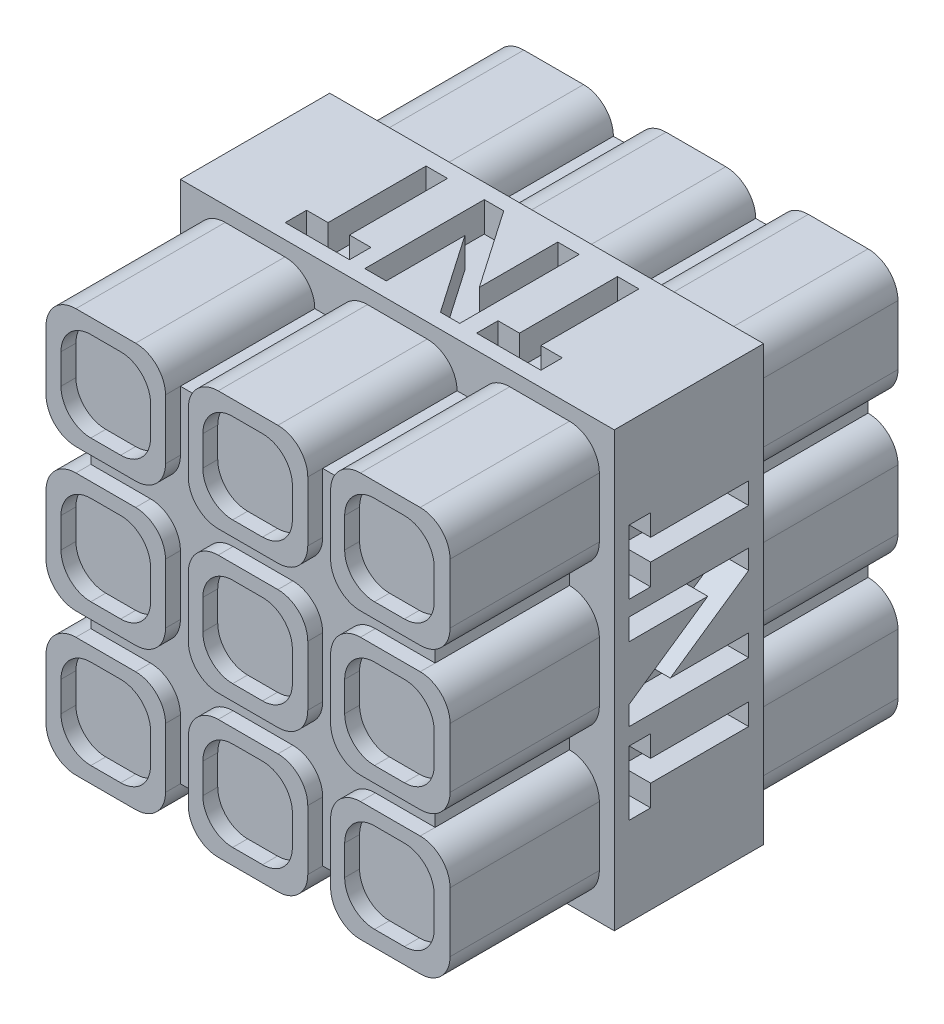
from build123d import *

# Parameters (mm, degrees)
BOSS_EXTRUDE1_DEPTH = 30
SKETCH2_W           = 29.058823529
SKETCH2_H           = 29.058823529
BOSS_EXTRUDE2_DEPTH = 10
CUT_EXTRUDE1_DEPTH  = 2
CIRPATTERN1_COUNT   = 4
CUT_EXTRUDE2_DEPTH  = 1
SKETCH6_W           = 23.058823529
SKETCH6_H           = 1.529411764
SKETCH6_H_2         = 1.529411765
CUT_EXTRUDE3_DEPTH  = 1
SKETCH7_W           = 1.529411765
SKETCH7_H           = 23.058823529
SKETCH7_W_2         = 1.529411764
CUT_EXTRUDE4_DEPTH  = 1
FILLET1_R           = 2


with BuildPart() as part:
    # Sketch1 → Boss-Extrude1 (new body)
    with BuildSketch(Plane.XY):
        with BuildLine():
            Line((0, -2), (0, -6))
            ThreePointArc((0, -6), (0.585786438, -7.414213562), (2, -8))
            Line((2, -8), (6, -8))
            ThreePointArc((6, -8), (7.414213562, -7.414213562), (8, -6))
            Line((8, -6), (9.529411765, -6))
            ThreePointArc((9.529411765, -6), (10.115198202, -7.414213562), (11.529411765, -8))
            Line((11.529411765, -8), (15.529411765, -8))
            ThreePointArc((15.529411765, -8), (16.943625327, -7.414213562), (17.529411765, -6))
            Line((17.529411765, -6), (19.058823529, -6))
            ThreePointArc((19.058823529, -6), (19.644609967, -7.414213562), (21.058823529, -8))
            Line((21.058823529, -8), (25.058823529, -8))
            ThreePointArc((25.058823529, -8), (26.473037092, -7.414213562), (27.058823529, -6))
            Line((27.058823529, -6), (27.058823529, -2))
            ThreePointArc((27.058823529, -2), (26.473037092, -0.585786438), (25.058823529, 0))
            Line((25.058823529, 0), (25.058823529, 1.529411765))
            ThreePointArc((25.058823529, 1.529411765), (26.473037092, 2.115198202), (27.058823529, 3.529411765))
            Line((27.058823529, 3.529411765), (27.058823529, 7.529411765))
            ThreePointArc((27.058823529, 7.529411765), (26.473037092, 8.943625327), (25.058823529, 9.529411765))
            Line((25.058823529, 9.529411765), (25.058823529, 11.058823529))
            ThreePointArc((25.058823529, 11.058823529), (26.473037092, 11.644609967), (27.058823529, 13.058823529))
            Line((27.058823529, 13.058823529), (27.058823529, 17.058823529))
            ThreePointArc((27.058823529, 17.058823529), (26.473037092, 18.473037092), (25.058823529, 19.058823529))
            Line((25.058823529, 19.058823529), (21.058823529, 19.058823529))
            ThreePointArc((21.058823529, 19.058823529), (19.644609967, 18.473037092), (19.058823529, 17.058823529))
            Line((19.058823529, 17.058823529), (17.529411765, 17.058823529))
            ThreePointArc((17.529411765, 17.058823529), (16.943625327, 18.473037092), (15.529411765, 19.058823529))
            Line((15.529411765, 19.058823529), (11.529411765, 19.058823529))
            ThreePointArc((11.529411765, 19.058823529), (10.115198202, 18.473037092), (9.529411765, 17.058823529))
            Line((9.529411765, 17.058823529), (8, 17.058823529))
            ThreePointArc((8, 17.058823529), (7.414213562, 18.473037092), (6, 19.058823529))
            Line((6, 19.058823529), (2, 19.058823529))
            ThreePointArc((2, 19.058823529), (0.585786438, 18.473037092), (0, 17.058823529))
            Line((0, 17.058823529), (0, 13.058823529))
            ThreePointArc((0, 13.058823529), (0.585786438, 11.644609967), (2, 11.058823529))
            Line((2, 11.058823529), (2, 9.529411765))
            ThreePointArc((2, 9.529411765), (0.585786438, 8.943625327), (0, 7.529411765))
            Line((0, 7.529411765), (0, 3.529411765))
            ThreePointArc((0, 3.529411765), (0.585786438, 2.115198202), (2, 1.529411765))
            Line((2, 1.529411765), (2, 0))
            ThreePointArc((2, 0), (0.585786438, -0.585786438), (0, -2))
        make_face()
    extrude(amount=BOSS_EXTRUDE1_DEPTH)

    # Sketch2 → Boss-Extrude2 (add)
    with BuildSketch(Plane.XY.offset(10)):
        with Locations((13.529411765, 5.529411765)):
            Rectangle(SKETCH2_W, SKETCH2_H)
    extrude(amount=BOSS_EXTRUDE2_DEPTH)

    # Sketch3 → Cut-Extrude1 (cut)
    with BuildSketch(Plane.ZY.offset(1)):
        Polygon((19, 14.14479638), (19, 9.837104072), (17.564102564, 9.837104072), (17.564102564, 11.273001508), (11, 11.273001508), (11, 12.708898944), (17.564102564, 12.708898944), (17.564102564, 14.14479638), align=None)
        Polygon((19, 8.708898944), (19, 7.415629713), (13.735576923, 3.785822021), (19, 3.785822021), (19, 2.349924585), (11, 2.349924585), (11, 3.652809201), (16.248397436, 7.273001508), (11, 7.273001508), (11, 8.708898944), align=None)
        Polygon((19, 1.32428356), (19, -2.983408748), (17.564102564, -2.983408748), (17.564102564, -1.547511312), (11, -1.547511312), (11, -0.111613876), (17.564102564, -0.111613876), (17.564102564, 1.32428356), align=None)
    cut_extrude1 = extrude(amount=-CUT_EXTRUDE1_DEPTH, mode=Mode.SUBTRACT)

    # CirPattern1: Cut-Extrude1 ×4 about axis
    cirpattern1_axis = Axis((13.529411765, 5.529411765, 0), (0, 0, 1))
    for i in range(1, CIRPATTERN1_COUNT):
        add(cut_extrude1.rotate(cirpattern1_axis, i * 360 / CIRPATTERN1_COUNT), mode=Mode.SUBTRACT)

    # Sketch5 → Cut-Extrude2 (cut)
    with BuildSketch(Plane.XY.offset(30)):
        with BuildLine():
            Line((3, 18.058823529), (5, 18.058823529))
            ThreePointArc((5, 18.058823529), (6.414213562, 17.473037092), (7, 16.058823529))
            Line((7, 16.058823529), (7, 14.058823529))
            ThreePointArc((7, 14.058823529), (6.414213562, 12.644609967), (5, 12.058823529))
            Line((5, 12.058823529), (3, 12.058823529))
            ThreePointArc((3, 12.058823529), (1.585786438, 12.644609967), (1, 14.058823529))
            Line((1, 14.058823529), (1, 16.058823529))
            ThreePointArc((1, 16.058823529), (1.585786438, 17.473037092), (3, 18.058823529))
        make_face()
        with BuildLine():
            Line((12.5, 18.058823529), (14.5, 18.058823529))
            ThreePointArc((14.5, 18.058823529), (15.914213562, 17.473037092), (16.5, 16.058823529))
            Line((16.5, 16.058823529), (16.5, 14.058823529))
            ThreePointArc((16.5, 14.058823529), (15.914213562, 12.644609967), (14.5, 12.058823529))
            Line((14.5, 12.058823529), (12.5, 12.058823529))
            ThreePointArc((12.5, 12.058823529), (11.085786438, 12.644609967), (10.5, 14.058823529))
            Line((10.5, 14.058823529), (10.5, 16.058823529))
            ThreePointArc((10.5, 16.058823529), (11.085786438, 17.473037092), (12.5, 18.058823529))
        make_face()
        with BuildLine():
            Line((22, 18.058823529), (24, 18.058823529))
            ThreePointArc((24, 18.058823529), (25.414213562, 17.473037092), (26, 16.058823529))
            Line((26, 16.058823529), (26, 14.058823529))
            ThreePointArc((26, 14.058823529), (25.414213562, 12.644609967), (24, 12.058823529))
            Line((24, 12.058823529), (22, 12.058823529))
            ThreePointArc((22, 12.058823529), (20.585786438, 12.644609967), (20, 14.058823529))
            Line((20, 14.058823529), (20, 16.058823529))
            ThreePointArc((20, 16.058823529), (20.585786438, 17.473037092), (22, 18.058823529))
        make_face()
        with BuildLine():
            Line((12.5, 8.558823529), (14.5, 8.558823529))
            ThreePointArc((14.5, 8.558823529), (15.914213562, 7.973037092), (16.5, 6.558823529))
            Line((16.5, 6.558823529), (16.5, 4.558823529))
            ThreePointArc((16.5, 4.558823529), (15.914213562, 3.144609967), (14.5, 2.558823529))
            Line((14.5, 2.558823529), (12.5, 2.558823529))
            ThreePointArc((12.5, 2.558823529), (11.085786438, 3.144609967), (10.5, 4.558823529))
            Line((10.5, 4.558823529), (10.5, 6.558823529))
            ThreePointArc((10.5, 6.558823529), (11.085786438, 7.973037092), (12.5, 8.558823529))
        make_face()
        with BuildLine():
            Line((22, 8.558823529), (24, 8.558823529))
            ThreePointArc((24, 8.558823529), (25.414213562, 7.973037092), (26, 6.558823529))
            Line((26, 6.558823529), (26, 4.558823529))
            ThreePointArc((26, 4.558823529), (25.414213562, 3.144609967), (24, 2.558823529))
            Line((24, 2.558823529), (22, 2.558823529))
            ThreePointArc((22, 2.558823529), (20.585786438, 3.144609967), (20, 4.558823529))
            Line((20, 4.558823529), (20, 6.558823529))
            ThreePointArc((20, 6.558823529), (20.585786438, 7.973037092), (22, 8.558823529))
        make_face()
        with BuildLine():
            Line((12.5, -0.941176471), (14.5, -0.941176471))
            ThreePointArc((14.5, -0.941176471), (15.914213562, -1.526962908), (16.5, -2.941176471))
            Line((16.5, -2.941176471), (16.5, -4.941176471))
            ThreePointArc((16.5, -4.941176471), (15.914213562, -6.355390033), (14.5, -6.941176471))
            Line((14.5, -6.941176471), (12.5, -6.941176471))
            ThreePointArc((12.5, -6.941176471), (11.085786438, -6.355390033), (10.5, -4.941176471))
            Line((10.5, -4.941176471), (10.5, -2.941176471))
            ThreePointArc((10.5, -2.941176471), (11.085786438, -1.526962908), (12.5, -0.941176471))
        make_face()
        with BuildLine():
            Line((22, -0.941176471), (24, -0.941176471))
            ThreePointArc((24, -0.941176471), (25.414213562, -1.526962908), (26, -2.941176471))
            Line((26, -2.941176471), (26, -4.941176471))
            ThreePointArc((26, -4.941176471), (25.414213562, -6.355390033), (24, -6.941176471))
            Line((24, -6.941176471), (22, -6.941176471))
            ThreePointArc((22, -6.941176471), (20.585786438, -6.355390033), (20, -4.941176471))
            Line((20, -4.941176471), (20, -2.941176471))
            ThreePointArc((20, -2.941176471), (20.585786438, -1.526962908), (22, -0.941176471))
        make_face()
        with BuildLine():
            Line((3, 8.558823529), (5, 8.558823529))
            ThreePointArc((5, 8.558823529), (6.414213562, 7.973037092), (7, 6.558823529))
            Line((7, 6.558823529), (7, 4.558823529))
            ThreePointArc((7, 4.558823529), (6.414213562, 3.144609967), (5, 2.558823529))
            Line((5, 2.558823529), (3, 2.558823529))
            ThreePointArc((3, 2.558823529), (1.585786438, 3.144609967), (1, 4.558823529))
            Line((1, 4.558823529), (1, 6.558823529))
            ThreePointArc((1, 6.558823529), (1.585786438, 7.973037092), (3, 8.558823529))
        make_face()
        with BuildLine():
            Line((3, -0.941176471), (5, -0.941176471))
            ThreePointArc((5, -0.941176471), (6.414213562, -1.526962908), (7, -2.941176471))
            Line((7, -2.941176471), (7, -4.941176471))
            ThreePointArc((7, -4.941176471), (6.414213562, -6.355390033), (5, -6.941176471))
            Line((5, -6.941176471), (3, -6.941176471))
            ThreePointArc((3, -6.941176471), (1.585786438, -6.355390033), (1, -4.941176471))
            Line((1, -4.941176471), (1, -2.941176471))
            ThreePointArc((1, -2.941176471), (1.585786438, -1.526962908), (3, -0.941176471))
        make_face()
    extrude(amount=-CUT_EXTRUDE2_DEPTH, mode=Mode.SUBTRACT)

    # Sketch6 → Cut-Extrude3 (cut)
    with BuildSketch(Plane.XY.offset(30)):
        with Locations((13.529411765, 10.294117647)):
            Rectangle(SKETCH6_W, SKETCH6_H)
        with Locations((13.529411765, 0.764705883)):
            Rectangle(SKETCH6_W, SKETCH6_H_2)
    extrude(amount=-CUT_EXTRUDE3_DEPTH, mode=Mode.SUBTRACT)

    # Sketch7 → Cut-Extrude4 (cut)
    with BuildSketch(Plane.XY.offset(30)):
        with Locations((8.764705882, 5.529411765)):
            Rectangle(SKETCH7_W, SKETCH7_H)
        with Locations((18.294117647, 5.529411765)):
            Rectangle(SKETCH7_W_2, SKETCH7_H)
    extrude(amount=-CUT_EXTRUDE4_DEPTH, mode=Mode.SUBTRACT)

    # Fillet1
    fillet1_edges = [part.edges().sort_by_distance(p)[0] for p in [
        (9.529411765, 0, 29.5),
        (9.529411765, 1.529411765, 29.5),
        (9.529411765, 9.529411765, 29.5),
        (9.529411765, 11.058823529, 29.5),
        (8, 0, 29.5),
        (8, 1.529411765, 29.5),
        (8, 9.529411765, 29.5),
        (8, 11.058823529, 29.5),
        (17.529411765, 0, 29.5),
        (17.529411765, 1.529411765, 29.5),
        (17.529411765, 9.529411765, 29.5),
        (17.529411765, 11.058823529, 29.5),
        (19.058823529, 0, 29.5),
        (19.058823529, 1.529411765, 29.5),
        (19.058823529, 9.529411765, 29.5),
        (19.058823529, 11.058823529, 29.5),
    ]]
    fillet(fillet1_edges, radius=FILLET1_R)


solid = part.part
